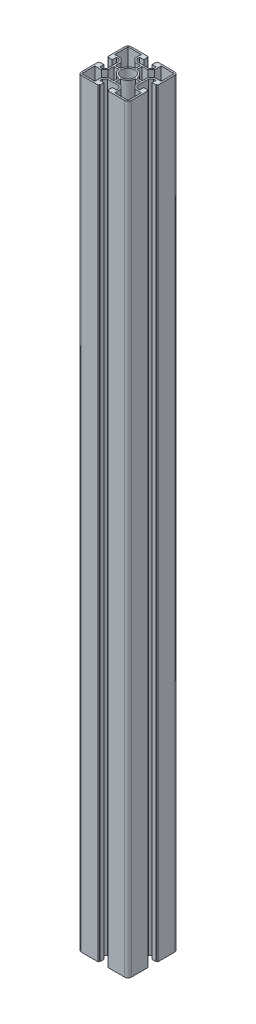
from build123d import *

# Parameters (mm, degrees)
SKETCH_1_R      = 8
EXTRUDE_1_DEPTH = 915


with BuildPart() as part:
    # 草图1 → 凸台-拉伸1 (new body)
    with BuildSketch(Plane(origin=(0, 0, 0), x_dir=(1, 0, 0), z_dir=(0, 1, 0))):
        with BuildLine():
            Line((-30, 5.999999999), (-28.5, 5.999999999))
            Line((-28.5, 5.999999999), (-28.5, 4.999999999))
            Line((-28.5, 4.999999999), (-24, 4.999999999))
            Line((-24, 4.999999999), (-24, 9.999999999))
            Line((-24, 9.999999999), (-21, 9.999999999))
            Line((-21, 9.999999999), (-18, 6.999999999))
            Line((-18, 6.999999999), (-18, -7.000000001))
            Line((-18, -7.000000001), (-21, -10.000000001))
            Line((-21, -10.000000001), (-24, -10.000000001))
            Line((-24, -10.000000001), (-24, -5.000000001))
            Line((-24, -5.000000001), (-28.5, -5.000000001))
            Line((-28.5, -5.000000001), (-28.5, -6.000000001))
            Line((-28.5, -6.000000001), (-30, -6.000000001))
            Line((-30, -6.000000001), (-30, -26.000000001))
            ThreePointArc((-30, -26.000000001), (-28.828427125, -28.828427126), (-26, -30.000000001))
            Line((-26, -30.000000001), (-6, -30.000000001))
            Line((-6, -30.000000001), (-6, -28.500000001))
            Line((-6, -28.500000001), (-5, -28.500000001))
            Line((-5, -28.500000001), (-5, -24.000000001))
            Line((-5, -24.000000001), (-10, -24.000000001))
            Line((-10, -24.000000001), (-10, -21.000000001))
            Line((-10, -21.000000001), (-7, -18.000000001))
            Line((-7, -18.000000001), (7, -18.000000001))
            Line((7, -18.000000001), (10, -21.000000001))
            Line((10, -21.000000001), (10, -24.000000001))
            Line((10, -24.000000001), (5, -24.000000001))
            Line((5, -24.000000001), (5, -28.500000001))
            Line((5, -28.500000001), (6, -28.500000001))
            Line((6, -28.500000001), (6, -30.000000001))
            Line((6, -30.000000001), (26, -30.000000001))
            ThreePointArc((26, -30.000000001), (28.828427125, -28.828427126), (30, -26.000000001))
            Line((30, -26.000000001), (30, -6.000000001))
            Line((30, -6.000000001), (28.5, -6.000000001))
            Line((28.5, -6.000000001), (28.5, -5.000000001))
            Line((28.5, -5.000000001), (24, -5.000000001))
            Line((24, -5.000000001), (24, -10.000000001))
            Line((24, -10.000000001), (21, -10.000000001))
            Line((21, -10.000000001), (18, -7.000000001))
            Line((18, -7.000000001), (18, 6.999999999))
            Line((18, 6.999999999), (21, 9.999999999))
            Line((21, 9.999999999), (24, 9.999999999))
            Line((24, 9.999999999), (24, 4.999999999))
            Line((24, 4.999999999), (28.5, 4.999999999))
            Line((28.5, 4.999999999), (28.5, 5.999999999))
            Line((28.5, 5.999999999), (30, 5.999999999))
            Line((30, 5.999999999), (30, 25.999999999))
            ThreePointArc((30, 25.999999999), (28.828427125, 28.828427124), (26, 29.999999999))
            Line((26, 29.999999999), (6, 29.999999999))
            Line((6, 29.999999999), (6, 28.499999999))
            Line((6, 28.499999999), (5, 28.499999999))
            Line((5, 28.499999999), (5, 23.999999999))
            Line((5, 23.999999999), (10, 23.999999999))
            Line((10, 23.999999999), (10, 20.999999999))
            Line((10, 20.999999999), (7, 17.999999999))
            Line((7, 17.999999999), (-7, 17.999999999))
            Line((-7, 17.999999999), (-10, 20.999999999))
            Line((-10, 20.999999999), (-10, 23.999999999))
            Line((-10, 23.999999999), (-5, 23.999999999))
            Line((-5, 23.999999999), (-5, 28.499999999))
            Line((-5, 28.499999999), (-6, 28.499999999))
            Line((-6, 28.499999999), (-6, 29.999999999))
            Line((-6, 29.999999999), (-26.000000001, 29.999999999))
            ThreePointArc((-26.000000001, 29.999999999), (-28.828427125, 28.828427123), (-30, 25.999999999))
            Line((-30, 25.999999999), (-30, 5.999999999))
        make_face()
        with Locations(Location((0, 0, 0), (0, 0, 90))):
            Circle(SKETCH_1_R, mode=Mode.SUBTRACT)
        with BuildLine():
            Line((-16, 1), (-9.949874371, 1))
            ThreePointArc((-9.949874371, 1), (-7.071067812, 7.071067811), (-1.000000001, 9.949874371))
            Line((-1.000000001, 9.949874371), (-1.000000001, 16))
            Line((-1.000000001, 16), (-7.828427125, 16))
            Line((-7.828427125, 16), (-12, 20.171572875))
            Line((-12, 20.171572875), (-12, 28))
            Line((-12, 28), (-28, 28))
            Line((-28, 28), (-28, 12))
            Line((-28, 12), (-20.171572875, 12))
            Line((-20.171572875, 12), (-16, 7.828427125))
            Line((-16, 7.828427125), (-16, 1))
        make_face(mode=Mode.SUBTRACT)
        with BuildLine():
            Line((1, 9.949874371), (1, 16))
            Line((1, 16), (7.828427125, 16))
            Line((7.828427125, 16), (12, 20.171572875))
            Line((12, 20.171572875), (12, 28))
            Line((12, 28), (28, 28))
            Line((28, 28), (28, 12.000000001))
            Line((28, 12.000000001), (20.171572875, 12.000000001))
            Line((20.171572875, 12.000000001), (16, 7.828427126))
            Line((16, 7.828427126), (16, 1.000000001))
            Line((16, 1.000000001), (9.949874371, 1.000000001))
            ThreePointArc((9.949874371, 1.000000001), (7.071067811, 7.071067812), (1, 9.949874371))
        make_face(mode=Mode.SUBTRACT)
        with BuildLine():
            Line((9.949874371, -1), (16, -1))
            Line((16, -1), (16, -7.828427125))
            Line((16, -7.828427125), (20.171572875, -12))
            Line((20.171572875, -12), (28.000000001, -12))
            Line((28.000000001, -12), (28.000000001, -28))
            Line((28.000000001, -28), (12.000000001, -28))
            Line((12.000000001, -28), (12.000000001, -20.171572875))
            Line((12.000000001, -20.171572875), (7.828427126, -16))
            Line((7.828427126, -16), (1.000000001, -16))
            Line((1.000000001, -16), (1.000000001, -9.949874371))
            ThreePointArc((1.000000001, -9.949874371), (7.071067812, -7.071067811), (9.949874371, -1))
        make_face(mode=Mode.SUBTRACT)
        with BuildLine():
            Line((-1, -9.949874371), (-1, -16.000000001))
            Line((-1, -16.000000001), (-7.828427125, -16.000000001))
            Line((-7.828427125, -16.000000001), (-12, -20.171572876))
            Line((-12, -20.171572876), (-12, -28.000000001))
            Line((-12, -28.000000001), (-28, -28.000000001))
            Line((-28, -28.000000001), (-28, -12.000000001))
            Line((-28, -12.000000001), (-20.171572875, -12.000000001))
            Line((-20.171572875, -12.000000001), (-16, -7.828427126))
            Line((-16, -7.828427126), (-16, -1.000000001))
            Line((-16, -1.000000001), (-9.949874371, -1.000000001))
            ThreePointArc((-9.949874371, -1.000000001), (-7.071067811, -7.071067812), (-1, -9.949874371))
        make_face(mode=Mode.SUBTRACT)
    extrude(amount=EXTRUDE_1_DEPTH)


solid = part.part
